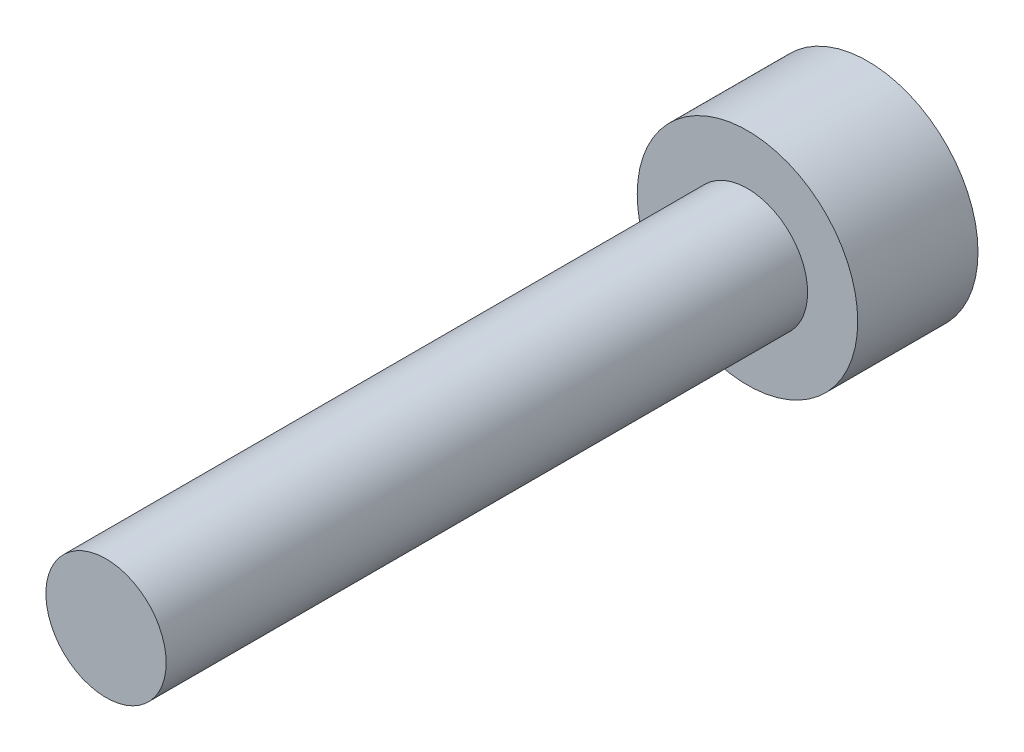
from build123d import *

# Parameters (mm, degrees)
CABEZA_START            = -3
SK_CABEZA_R             = 2.75
CABEZA_DEPTH            = 3
SK_CUERPO_R             = 1.5
CUERPO_DEPTH            = 16
HEXAGONO_INTERIOR_START = -3
HEXAGONO_INTERIOR_DEPTH = 1.5


with BuildPart() as part:
    # Sk_Cabeza → Cabeza (new body)
    with BuildSketch(Plane.XY.offset(CABEZA_START)):
        Circle(SK_CABEZA_R)
    extrude(amount=CABEZA_DEPTH)

    # Sk_Cuerpo → Cuerpo (add)
    with BuildSketch(Plane.XY):
        Circle(SK_CUERPO_R)
    extrude(amount=CUERPO_DEPTH)

    # Sk_Hexagono_interior → Hexagono_interior (cut)
    with BuildSketch(Plane.XY.offset(HEXAGONO_INTERIOR_START)):
        Polygon((0, -1.443375673), (1.25, -0.721687836), (1.25, 0.721687836), (0, 1.443375673), (-1.25, 0.721687836), (-1.25, -0.721687836), align=None)
    extrude(amount=HEXAGONO_INTERIOR_DEPTH, mode=Mode.SUBTRACT)


solid = part.part
